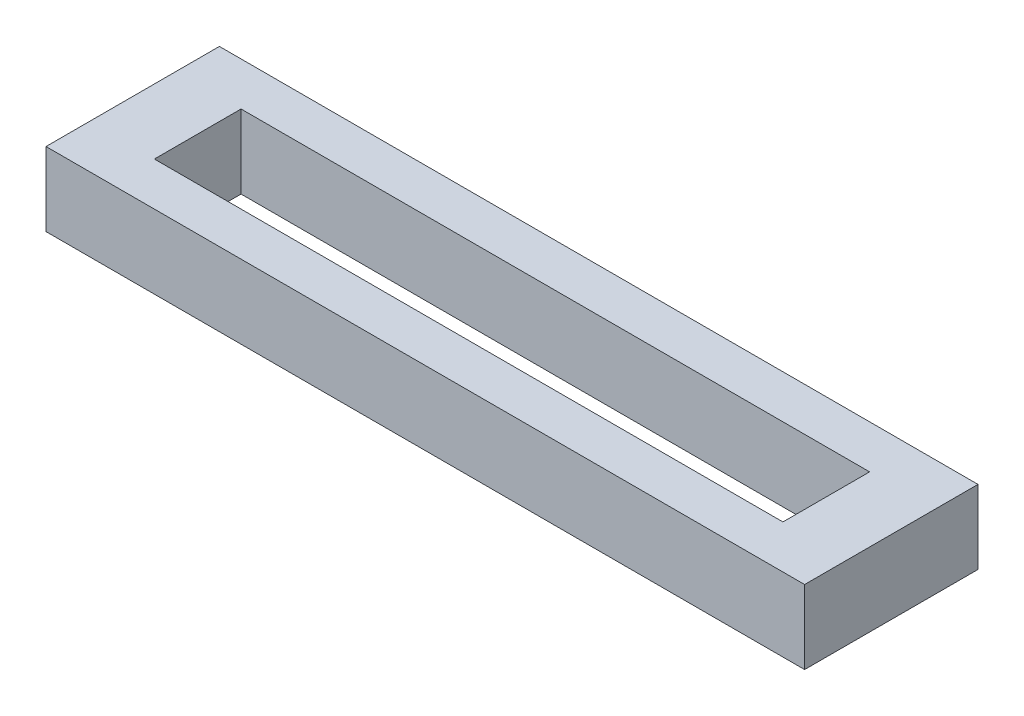
from build123d import *

# Parameters (mm, degrees)
SKETCH_1_W      = 35
SKETCH_1_H      = 8
SKETCH_1_W_2    = 29
SKETCH_1_H_2    = 4
EXTRUDE_1_DEPTH = 3.4


with BuildPart() as part:
    # 草图1 → 凸台-拉伸1 (new body)
    with BuildSketch(Plane(origin=(0, 0, 0), x_dir=(1, 0, 0), z_dir=(0, 1, 0))):
        Rectangle(SKETCH_1_W, SKETCH_1_H)
        Rectangle(SKETCH_1_W_2, SKETCH_1_H_2, mode=Mode.SUBTRACT)
    extrude(amount=EXTRUDE_1_DEPTH)


solid = part.part
